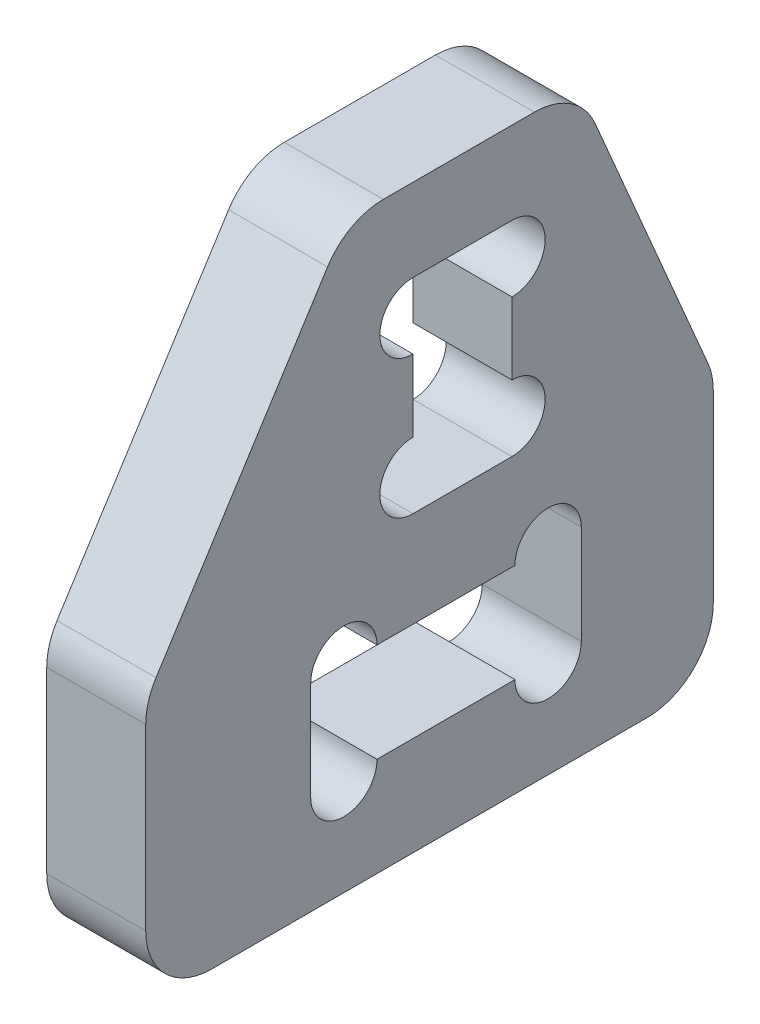
from build123d import *

# Parameters (mm, degrees)
EXTRUDE_1_DEPTH = 3
FILLET_1_R      = 2


with BuildPart() as part:
    # 草图1 → 凸台-拉伸1 (new body)
    with BuildSketch(Plane(origin=(0, 0, 0), x_dir=(0, 0, -1), z_dir=(1, 0, 0))):
        Polygon((3.5, 5.6), (-3.5, 5.6), (-9.6, -4), (-9.6, -12), (7.6, -12), (7.6, -4), align=None)
        with BuildLine():
            ThreePointArc((-2.59, -9), (-3.595, -10.005), (-4.6, -9))
            Line((-4.6, -9), (-4.6, -6))
            ThreePointArc((-4.6, -6), (-3.595, -4.995), (-2.59, -6))
            Line((-2.59, -6), (1.59, -6))
            ThreePointArc((1.59, -6), (2.595, -4.995), (3.6, -6))
            Line((3.6, -6), (3.6, -9))
            ThreePointArc((3.6, -9), (2.595, -10.005), (1.59, -9))
            Line((1.59, -9), (-2.59, -9))
        make_face(mode=Mode.SUBTRACT)
        with BuildLine():
            ThreePointArc((2.505, -2.095), (2.210642315, -2.805642315), (1.5, -3.1))
            Line((1.5, -3.1), (-1.5, -3.1))
            ThreePointArc((-1.5, -3.1), (-2.505, -2.095), (-1.5, -1.09))
            Line((-1.5, -1.09), (-1.5, 1.09))
            ThreePointArc((-1.5, 1.09), (-2.505, 2.095), (-1.5, 3.1))
            Line((-1.5, 3.1), (1.5, 3.1))
            ThreePointArc((1.5, 3.1), (2.210642315, 2.805642315), (2.505, 2.095))
            ThreePointArc((2.505, 2.095), (2.210642315, 1.384357685), (1.5, 1.09))
            Line((1.5, 1.09), (1.5, -1.09))
            ThreePointArc((1.5, -1.09), (2.210642315, -1.384357685), (2.505, -2.095))
        make_face(mode=Mode.SUBTRACT)
    extrude(amount=EXTRUDE_1_DEPTH)

    # 圆角1
    fillet_1_edges = [part.edges().sort_by_distance(p)[0] for p in [
        (1.5, 5.6, 3.5),
        (1.5, 5.6, -3.5),
        (1.5, -4, -7.6),
        (1.5, -12, -7.6),
        (1.5, -12, 9.6),
        (1.5, -4, 9.6),
    ]]
    fillet(fillet_1_edges, radius=FILLET_1_R)


solid = part.part
